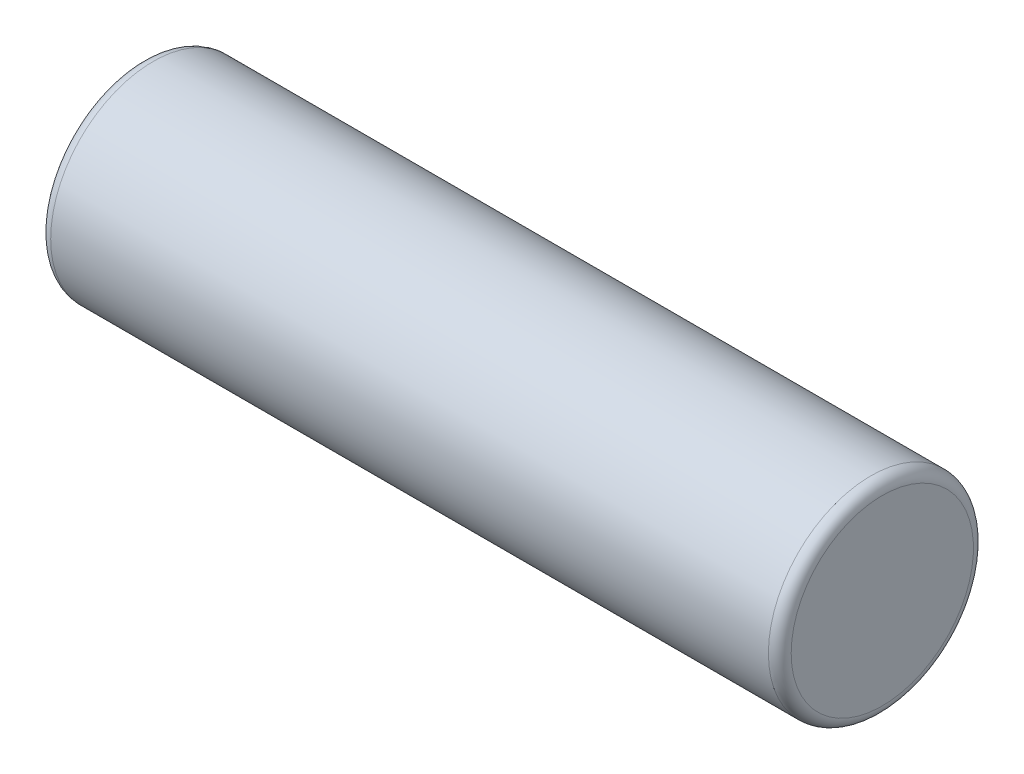
from build123d import *

# Parameters (mm, degrees)
SKETCH3_W = 65
SKETCH3_H = 9
FILLET1_R = 1


with BuildPart() as part:
    # Sketch3 → Revolve2 (revolve)
    with BuildSketch(Plane(origin=(0, 0, 0), x_dir=(1, 0, 0), z_dir=(0, 1, 0)), mode=Mode.PRIVATE) as revolve2_sk:
        Rectangle(SKETCH3_W, SKETCH3_H)
    revolve(revolve2_sk.sketch.rotate(Axis((-32.5, 0, 4.5), (1, 0, 0)), 180), axis=Axis((-32.5, 0, 4.5), (1, 0, 0)))

    # Fillet1
    fillet1_edges = [part.edges().sort_by_distance(p)[0] for p in [
        (32.5, 0, -4.5),
        (-32.5, 0, -4.5),
    ]]
    fillet(fillet1_edges, radius=FILLET1_R)


solid = part.part
